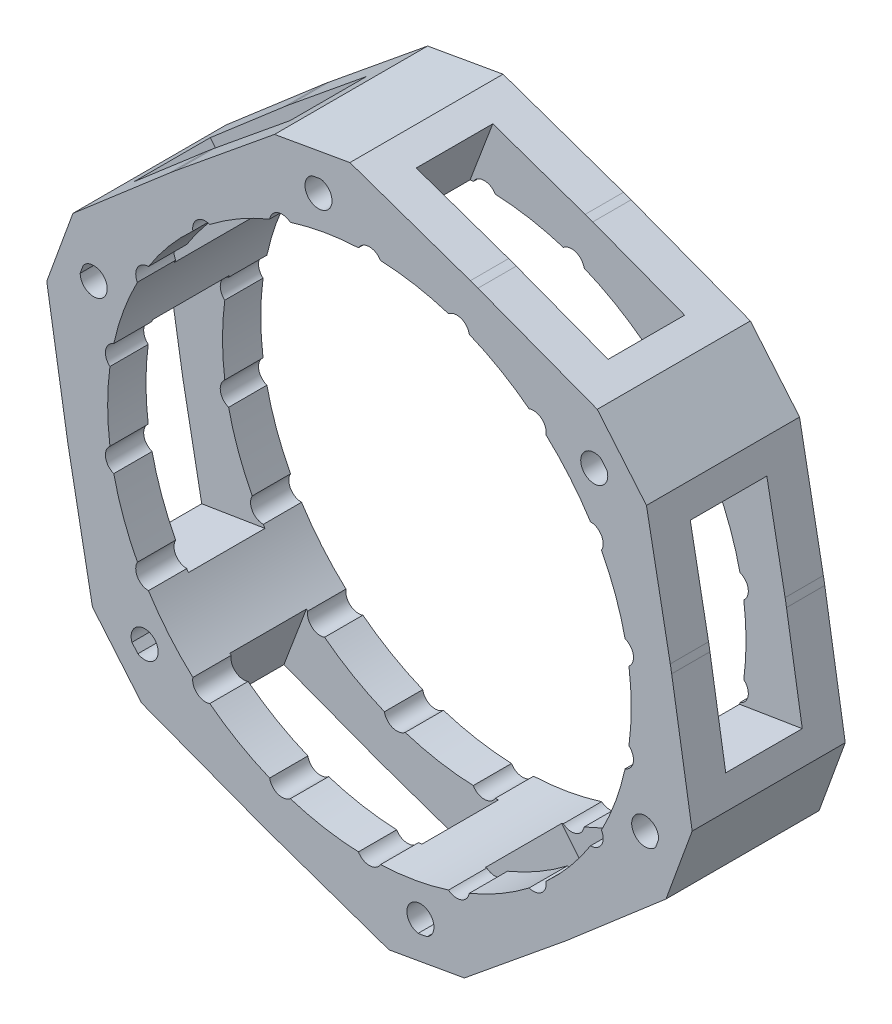
from build123d import *

# Parameters (mm, degrees)
SKETCH1_R           = 60
BOSS_EXTRUDE1_DEPTH = 30
SKETCH2_R           = 2.65
CUT_EXTRUDE2_DEPTH  = 91
BOSS_EXTRUDE2_START = -30
BOSS_EXTRUDE2_DEPTH = 30
SKETCH4_W           = 15
SKETCH4_H           = 40
CUT_EXTRUDE3_DEPTH  = 22
CIRPATTERN1_COUNT   = 6


with BuildPart() as part:
    # Sketch1 → Boss-Extrude1 (new body)
    with BuildSketch(Plane.XY):
        Circle(SKETCH1_R)
        with BuildLine():
            ThreePointArc((15.497935779, 48.903005905), (8.908151514, 50.52063773), (2.1625172, 51.2544))
            ThreePointArc((2.1625172, 51.2544), (0, 52.5), (-2.1625172, 51.2544))
            ThreePointArc((-2.1625172, 51.2544), (-8.908151514, 50.52063773), (-15.497935779, 48.903005905))
            ThreePointArc((-15.497935779, 48.903005905), (-17.956057525, 49.333862591), (-19.562138689, 47.42375702))
            ThreePointArc((-19.562138689, 47.42375702), (-25.65, 44.427103214), (-31.289108978, 40.653187567))
            ThreePointArc((-31.289108978, 40.653187567), (-33.746349509, 40.217333264), (-34.602277546, 37.873109044))
            ThreePointArc((-34.602277546, 37.873109044), (-39.298079932, 32.975004377), (-43.306353856, 27.499994831))
            ThreePointArc((-43.306353856, 27.499994831), (-45.466333699, 26.25), (-45.468871056, 23.754405169))
            ThreePointArc((-45.468871056, 23.754405169), (-48.206231446, 17.545633353), (-50.100213325, 11.029896862))
            ThreePointArc((-50.100213325, 11.029896862), (-51.702407033, 9.116529328), (-50.851247667, 6.770569453))
            ThreePointArc((-50.851247667, 6.770569453), (-51.3, 0), (-50.851247667, -6.770569453))
            ThreePointArc((-50.851247667, -6.770569453), (-51.702407033, -9.116529327), (-50.100213325, -11.029896862))
            ThreePointArc((-50.100213325, -11.029896862), (-48.206231446, -17.545633353), (-45.468871056, -23.754405169))
            ThreePointArc((-45.468871056, -23.754405169), (-45.466333699, -26.25), (-43.306353856, -27.499994831))
            ThreePointArc((-43.306353856, -27.499994831), (-39.298079932, -32.975004377), (-34.602277546, -37.873109043))
            ThreePointArc((-34.602277546, -37.873109043), (-33.746349509, -40.217333264), (-31.289108978, -40.653187567))
            ThreePointArc((-31.289108978, -40.653187567), (-25.65, -44.427103214), (-19.562138689, -47.42375702))
            ThreePointArc((-19.562138689, -47.42375702), (-17.956057525, -49.333862591), (-15.497935779, -48.903005905))
            ThreePointArc((-15.497935779, -48.903005905), (-8.908151515, -50.520637729), (-2.1625172, -51.2544))
            ThreePointArc((-2.1625172, -51.2544), (0, -52.5), (2.1625172, -51.2544))
            ThreePointArc((2.1625172, -51.2544), (8.908151514, -50.52063773), (15.497935779, -48.903005906))
            ThreePointArc((15.497935779, -48.903005906), (17.956057524, -49.333862591), (19.562138689, -47.42375702))
            ThreePointArc((19.562138689, -47.42375702), (25.65, -44.427103214), (31.289108978, -40.653187567))
            ThreePointArc((31.289108978, -40.653187567), (33.746349508, -40.217333264), (34.602277546, -37.873109044))
            ThreePointArc((34.602277546, -37.873109044), (39.298079932, -32.975004377), (43.306353856, -27.499994831))
            ThreePointArc((43.306353856, -27.499994831), (45.466333699, -26.25), (45.468871056, -23.754405169))
            ThreePointArc((45.468871056, -23.754405169), (48.206231446, -17.545633353), (50.100213325, -11.029896862))
            ThreePointArc((50.100213325, -11.029896862), (51.702407033, -9.116529328), (50.851247667, -6.770569453))
            ThreePointArc((50.851247667, -6.770569453), (51.3, 0), (50.851247667, 6.770569453))
            ThreePointArc((50.851247667, 6.770569453), (51.702407033, 9.116529327), (50.100213325, 11.029896862))
            ThreePointArc((50.100213325, 11.029896862), (48.206231446, 17.545633352), (45.468871056, 23.754405169))
            ThreePointArc((45.468871056, 23.754405169), (45.466333699, 26.25), (43.306353856, 27.499994831))
            ThreePointArc((43.306353856, 27.499994831), (39.298079932, 32.975004377), (34.602277546, 37.873109044))
            ThreePointArc((34.602277546, 37.873109044), (33.746349509, 40.217333264), (31.289108978, 40.653187567))
            ThreePointArc((31.289108978, 40.653187567), (25.65, 44.427103214), (19.562138689, 47.42375702))
            ThreePointArc((19.562138689, 47.42375702), (17.956057525, 49.333862591), (15.497935779, 48.903005905))
        make_face(mode=Mode.SUBTRACT)
    extrude(amount=BOSS_EXTRUDE1_DEPTH)

    # Sketch2 → Cut-Extrude2 (cut, through all)
    with BuildSketch(Plane.XY.offset(30)):
        with Locations((-9.984770216, 56.626445798)):
            Circle(SKETCH2_R)
        with Locations((44.047555479, 36.960287557)):
            Circle(SKETCH2_R)
        with Locations((54.032325695, -19.666158241)):
            Circle(SKETCH2_R)
        with Locations((9.984770216, -56.626445798)):
            Circle(SKETCH2_R)
        with Locations((-44.047555479, -36.960287557)):
            Circle(SKETCH2_R)
        with Locations((-54.032325695, 19.666158241)):
            Circle(SKETCH2_R)
    extrude(amount=-CUT_EXTRUDE2_DEPTH, mode=Mode.SUBTRACT)

    # Sketch3 → Boss-Extrude2 (add)
    with BuildSketch(Plane.XY.offset(30).offset(BOSS_EXTRUDE2_START)):
        with BuildLine():
            Line((-37.958811886, 46.46642444), (-18.597801703, 62.282596059))
            Line((-18.597801703, 62.282596059), (-3.825685408, 64.887318724))
            Line((-3.825685408, 64.887318724), (19.777162276, 56.646834442))
            ThreePointArc((19.777162276, 56.646834442), (-10.41889066, 59.088465181), (-37.958811886, 46.46642444))
        make_face()
        with BuildLine():
            Line((54.281223694, 35.756800112), (58.946178809, 11.195892275))
            ThreePointArc((58.946178809, 11.195892275), (45.962666587, 38.567256581), (21.261698045, 56.106507611))
            Line((21.261698045, 56.106507611), (44.639409549, 47.247466759))
            Line((44.639409549, 47.247466759), (54.281223694, 35.756800112))
        make_face()
        with BuildLine():
            Line((58.106909102, -29.130518612), (39.169016532, -45.450942167))
            ThreePointArc((39.169016532, -45.450942167), (56.381557247, -20.5212086), (59.220509931, 9.640083171))
            Line((59.220509931, 9.640083171), (63.237211252, -15.0351293))
            Line((63.237211252, -15.0351293), (58.106909102, -29.130518612))
        make_face()
        with BuildLine():
            Line((3.825685408, -64.887318724), (-19.777162276, -56.646834442))
            ThreePointArc((-19.777162276, -56.646834442), (10.41889066, -59.088465181), (37.958811886, -46.46642444))
            Line((37.958811886, -46.46642444), (18.597801703, -62.282596059))
            Line((18.597801703, -62.282596059), (3.825685408, -64.887318724))
        make_face()
        with BuildLine():
            Line((-54.281223694, -35.756800112), (-58.946178809, -11.195892275))
            ThreePointArc((-58.946178809, -11.195892275), (-45.962666587, -38.567256581), (-21.261698045, -56.106507611))
            Line((-21.261698045, -56.106507611), (-44.639409549, -47.247466759))
            Line((-44.639409549, -47.247466759), (-54.281223694, -35.756800112))
        make_face()
        with BuildLine():
            Line((-58.106909102, 29.130518612), (-39.169016532, 45.450942167))
            ThreePointArc((-39.169016532, 45.450942167), (-56.381557247, 20.5212086), (-59.220509931, -9.640083171))
            Line((-59.220509931, -9.640083171), (-63.237211252, 15.0351293))
            Line((-63.237211252, 15.0351293), (-58.106909102, 29.130518612))
        make_face()
    extrude(amount=BOSS_EXTRUDE2_DEPTH)

    # Sketch4 → Cut-Extrude3 (cut)
    with BuildSketch(Plane(origin=(-59.220509931, -9.640083171, 0), x_dir=(0, 0, 1), z_dir=(-0.9870084988456146, -0.16066805284973856, 0))):
        with Locations((15, -0.75)):
            Rectangle(SKETCH4_W, SKETCH4_H)
    cut_extrude3 = extrude(amount=-CUT_EXTRUDE3_DEPTH, mode=Mode.SUBTRACT)

    # CirPattern1: Cut-Extrude3 ×6 about axis
    cirpattern1_axis = Axis((0, 0, 0), (0, 0, 1))
    for i in range(1, CIRPATTERN1_COUNT):
        add(cut_extrude3.rotate(cirpattern1_axis, i * 360 / CIRPATTERN1_COUNT), mode=Mode.SUBTRACT)


solid = part.part
